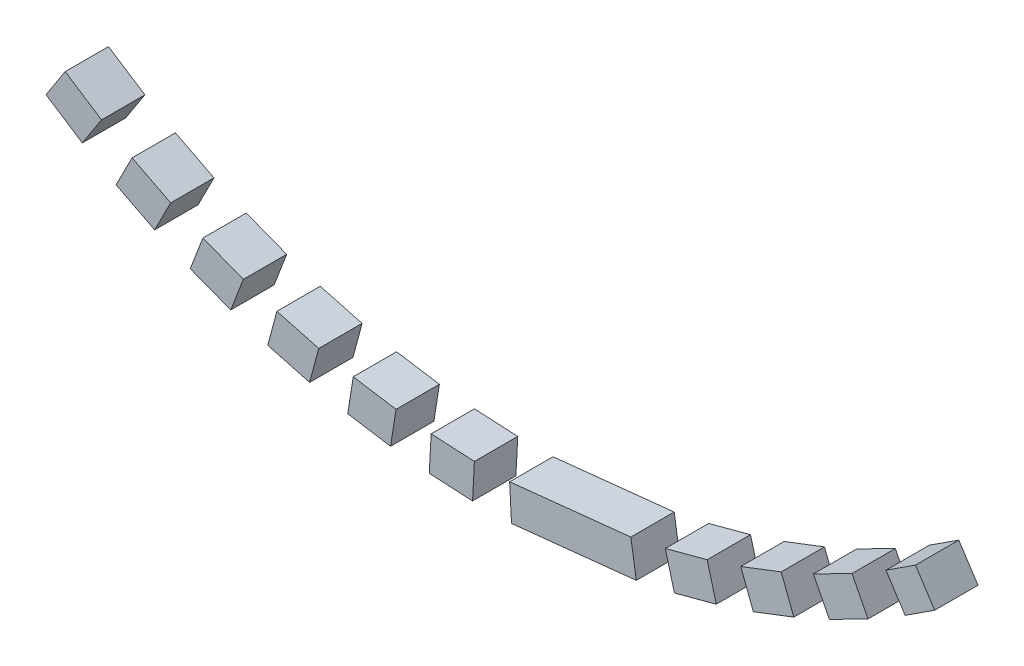
from build123d import *

# Parameters (mm, degrees)
CONTACTS_DEPTH    = 1.6
CONTACTS_2_DEPTH  = 1.6
CONTACTS_3_DEPTH  = 1.6
CONTACTS_4_DEPTH  = 1.6
CONTACTS_5_DEPTH  = 1.6
CONTACTS_6_DEPTH  = 1.6
CONTACTS_7_DEPTH  = 1.6
CONTACTS_8_DEPTH  = 1.6
CONTACTS_9_DEPTH  = 1.6
CONTACTS_10_DEPTH = 1.6
CONTACTS_11_DEPTH = 1.6


with BuildPart() as part:
    # Sketch3 → Contacts (new body)
    with BuildSketch(Plane.XY):
        Polygon((-16.46546847, -23.885735242), (-15.123595561, -24.757157698), (-14.415564816, -23.66688596), (-15.757437724, -22.795463504), align=None)
    extrude(amount=CONTACTS_DEPTH)


with BuildPart() as body_2:
    # Sketch3 → Contacts 2 (new body)
    with BuildSketch(Plane.XY):
        Polygon((-13.878529712, -25.475996802), (-12.452919273, -26.202381601), (-11.862731623, -25.04407312), (-13.288342062, -24.31768832), align=None)
    extrude(amount=CONTACTS_2_DEPTH)


with BuildPart() as body_3:
    # Sketch3 → Contacts 3 (new body)
    with BuildSketch(Plane.XY):
        Polygon((-11.139534878, -26.787138009), (-9.645806196, -27.360526728), (-9.179927861, -26.146872174), (-10.673656544, -25.573483454), align=None)
    extrude(amount=CONTACTS_3_DEPTH)


with BuildPart() as body_4:
    # Sketch3 → Contacts 4 (new body)
    with BuildSketch(Plane.XY):
        Polygon((-8.278492969, -27.804793726), (-6.733011647, -28.218904198), (-6.396546888, -26.963200624), (-7.94202821, -26.549090152), align=None)
    extrude(amount=CONTACTS_4_DEPTH)


with BuildPart() as body_5:
    # Sketch3 → Contacts 5 (new body)
    with BuildSketch(Plane.XY):
        Polygon((-5.326750159, -28.517814305), (-3.746448814, -28.768109449), (-3.543084009, -27.484114607), (-5.123385354, -27.233819462), align=None)
    extrude(amount=CONTACTS_5_DEPTH)


with BuildPart() as body_6:
    # Sketch3 → Contacts 6 (new body)
    with BuildSketch(Plane.XY):
        Polygon((-2.316646359, -28.918387743), (-0.718839103, -29.002125273), (-0.65080236, -27.703906878), (-2.248609616, -27.620169348), align=None)
    extrude(amount=CONTACTS_6_DEPTH)


with BuildPart() as body_7:
    # Sketch3 → Contacts 7 (new body)
    with BuildSketch(Plane.XY):
        Polygon((0.718839103, -29.002125273), (0.65080236, -27.703906878), (5.123385354, -27.233819462), (5.326750159, -28.517814305), align=None)
    extrude(amount=CONTACTS_7_DEPTH)


with BuildPart() as body_8:
    # Sketch3 → Contacts 8 (new body)
    with BuildSketch(Plane.XY):
        Polygon((6.733011647, -28.218904198), (8.278492969, -27.804793726), (7.94202821, -26.549090152), (6.396546888, -26.963200624), align=None)
    extrude(amount=CONTACTS_8_DEPTH)


with BuildPart() as body_9:
    # Sketch3 → Contacts 9 (new body)
    with BuildSketch(Plane.XY):
        Polygon((9.645806196, -27.360526728), (11.139534878, -26.787138009), (10.673656544, -25.573483454), (9.179927861, -26.146872174), align=None)
    extrude(amount=CONTACTS_9_DEPTH)


with BuildPart() as body_10:
    # Sketch3 → Contacts 10 (new body)
    with BuildSketch(Plane.XY):
        Polygon((12.452919273, -26.202381601), (13.878529712, -25.475996802), (13.288342062, -24.31768832), (11.862731623, -25.04407312), align=None)
    extrude(amount=CONTACTS_10_DEPTH)


with BuildPart() as body_11:
    # Sketch3 → Contacts 11 (new body)
    with BuildSketch(Plane.XY):
        Polygon((15.249396146, -24.675461843), (16.339667885, -23.967431098), (15.631637139, -22.877159359), (14.541365401, -23.585190105), align=None)
    extrude(amount=CONTACTS_11_DEPTH)


solid = Compound([part.part, body_2.part, body_3.part, body_4.part, body_5.part, body_6.part, body_7.part, body_8.part, body_9.part, body_10.part, body_11.part])
